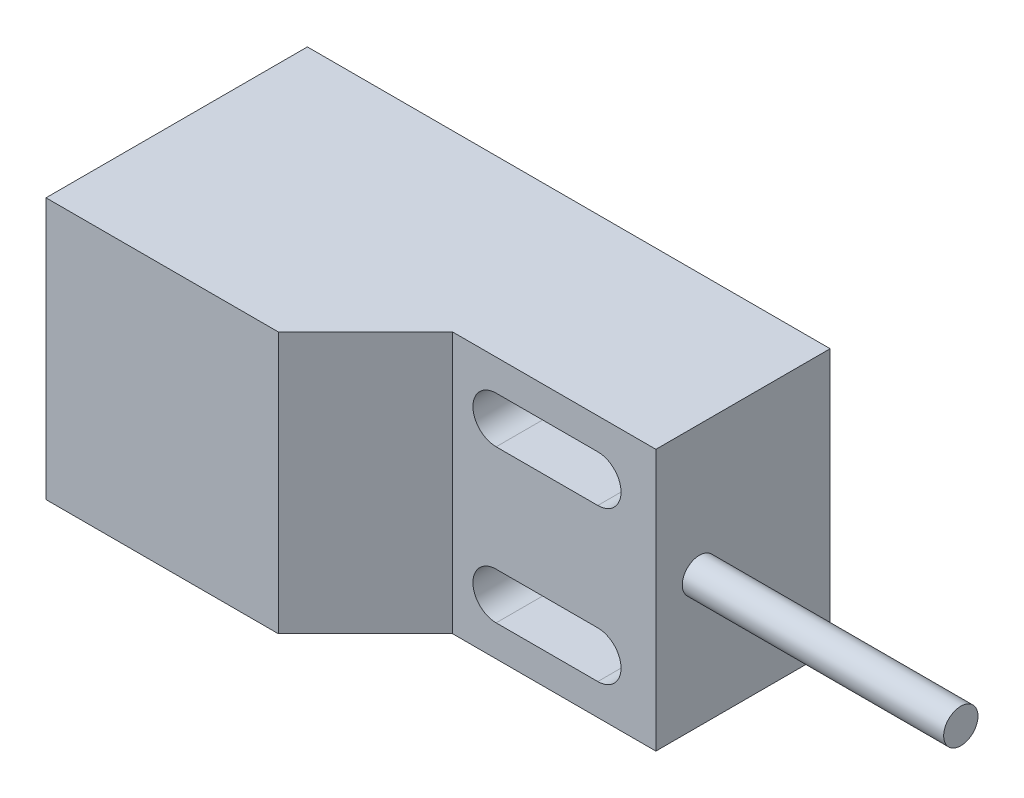
from build123d import *

# Parameters (mm, degrees)
SZKIC1_W                    = 36
SZKIC1_H                    = 18
DODANIE_WYCI_GNI_CIE1_DEPTH = 9
WYTNIJ_WYCI_GNI_CIE1_DEPTH  = 18
SZKIC3_R                    = 1.182612818
DODANIE_WYCI_GNI_CIE2_DEPTH = 18
WYTNIJ_WYCI_GNI_CIE2_DEPTH  = 40


with BuildPart() as part:
    # Szkic1 → Dodanie-wyciągnięcie1 (new, symmetric)
    with BuildSketch(Plane.XY):
        Rectangle(SZKIC1_W, SZKIC1_H)
    extrude(amount=DODANIE_WYCI_GNI_CIE1_DEPTH, both=True)

    # Szkic2 → Wytnij-wyciągnięcie1 (cut)
    with BuildSketch(Plane.XZ.offset(9)):
        Polygon((-2, 9), (4, 3), (18, 3), (18, 9), align=None)
    extrude(amount=-WYTNIJ_WYCI_GNI_CIE1_DEPTH, mode=Mode.SUBTRACT)

    # Szkic3 → Dodanie-wyciągnięcie2 (add)
    with BuildSketch(Plane(origin=(18, 0, 0), x_dir=(0, 0, -1), z_dir=(1, 0, 0))):
        with Locations(Location((0, 0, 0), (0, 0, 180))):
            Circle(SZKIC3_R)
    extrude(amount=DODANIE_WYCI_GNI_CIE2_DEPTH)

    # Szkic4 → Wytnij-wyciągnięcie2 (cut, through all)
    with BuildSketch(Plane.XY.offset(3)):
        with BuildLine():
            Line((7, 6.85), (14, 6.85))
            ThreePointArc((14, 6.85), (15.6, 5.25), (14, 3.65))
            Line((14, 3.65), (7, 3.65))
            ThreePointArc((7, 3.65), (5.4, 5.25), (7, 6.85))
        make_face()
        with BuildLine():
            Line((7, -6.85), (14, -6.85))
            ThreePointArc((14, -6.85), (15.6, -5.25), (14, -3.65))
            Line((14, -3.65), (7, -3.65))
            ThreePointArc((7, -3.65), (5.4, -5.25), (7, -6.85))
        make_face()
    extrude(amount=-WYTNIJ_WYCI_GNI_CIE2_DEPTH, mode=Mode.SUBTRACT)


solid = part.part
